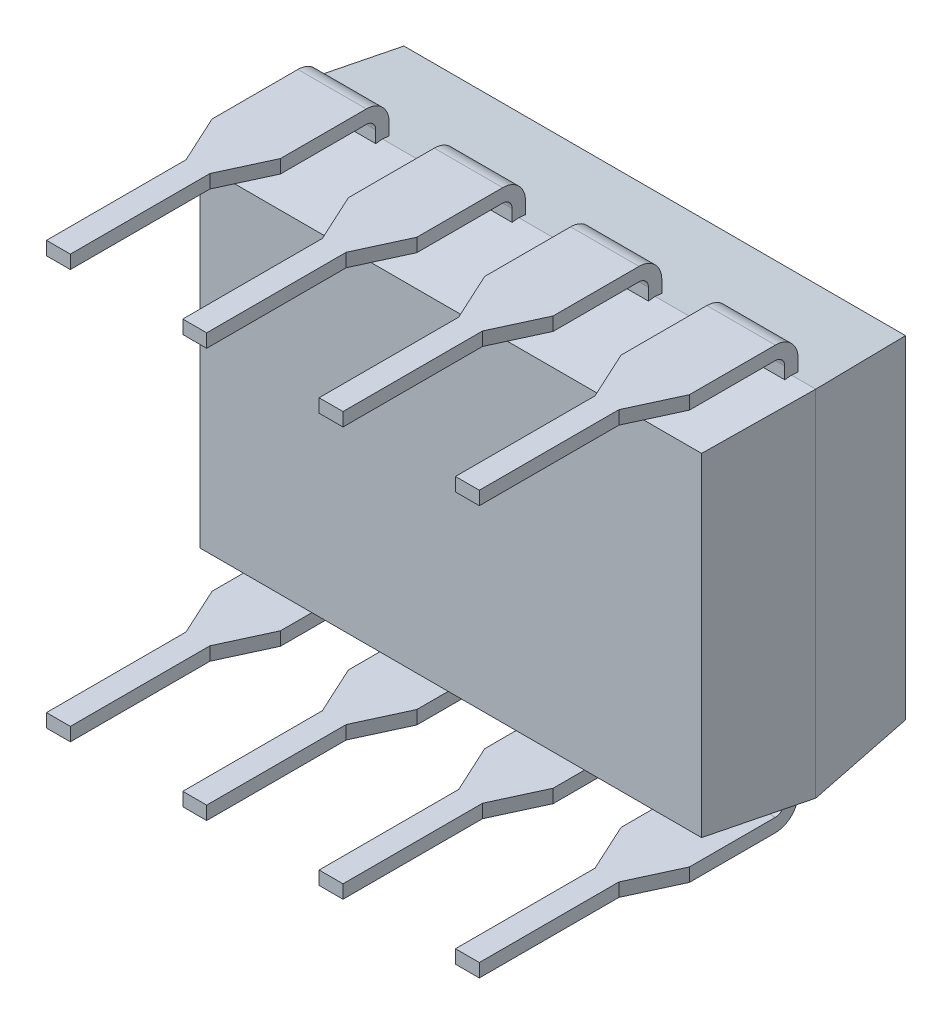
from build123d import *

# Parameters (mm, degrees)
RESSALTO_EXTRUS_O1_DEPTH        = 4.9
CORTE_EXTRUS_O2_DEPTH           = 3.55
ESBO_O8_R                       = 1
CORTE_EXTRUS_O5_DEPTH           = 0.5
ESBO_O6_W                       = 1.275
ESBO_O6_H                       = 0.25
RESSALTO_EXTRUS_O2_DEPTH        = 0.025
ESBO_O7_W                       = 1.275
ESBO_O7_H                       = 0.25
CORTE_EXTRUS_O6_START           = -0.25
CORTE_EXTRUS_O6_DEPTH           = 0.25
ESBO_O10_W                      = 0.445
ESBO_O10_H                      = 0.25
RESSALTO_EXTRUS_O3_DEPTH        = 2.6
PADR_O_LINEAR1_COUNT            = 4
PADR_O_LINEAR1_PITCH            = 2.54
PADR_O_LINEAR1_COPY_1_SKETCH_W  = 1.275
PADR_O_LINEAR1_COPY_1_SKETCH_H  = 0.25
PADR_O_LINEAR1_COPY_1_DEPTH     = 0.025
PADR_O_LINEAR1_COPY_2_SKETCH_W  = 1.275
PADR_O_LINEAR1_COPY_2_SKETCH_H  = 0.25
PADR_O_LINEAR1_COPY_2_DEPTH     = 0.025
PADR_O_LINEAR1_COPY_3_SKETCH_W  = 1.275
PADR_O_LINEAR1_COPY_3_SKETCH_H  = 0.25
PADR_O_LINEAR1_COPY_3_DEPTH     = 0.025
PADR_O_LINEAR1_COPY_4_SKETCH_W  = 1.275
PADR_O_LINEAR1_COPY_4_SKETCH_H  = 0.25
PADR_O_LINEAR1_COPY_5_SKETCH_W  = 1.275
PADR_O_LINEAR1_COPY_5_SKETCH_H  = 0.25
PADR_O_LINEAR1_COPY_6_SKETCH_W  = 1.275
PADR_O_LINEAR1_COPY_6_SKETCH_H  = 0.25
PADR_O_START                    = -0.25
PADR_O_LINEAR1_COPY_7_DEPTH     = 0.25
PADR_O_LINEAR1_COPY_8_DEPTH     = 0.25
PADR_O_LINEAR1_COPY_9_DEPTH     = 0.25
PADR_O_LINEAR1_COPY_10_SKETCH_W = 0.445
PADR_O_LINEAR1_COPY_10_SKETCH_H = 0.25
PADR_O_LINEAR1_COPY_10_DEPTH    = 2.6
PADR_O_LINEAR1_COPY_11_SKETCH_W = 0.445
PADR_O_LINEAR1_COPY_11_SKETCH_H = 0.25
PADR_O_LINEAR1_COPY_11_DEPTH    = 2.6
PADR_O_LINEAR1_COPY_12_SKETCH_W = 0.445
PADR_O_LINEAR1_COPY_12_SKETCH_H = 0.25
PADR_O_LINEAR1_COPY_12_DEPTH    = 2.6


with BuildPart() as part:
    # Esboço1 → Ressalto-extrusão1 (new, symmetric)
    with BuildSketch(Plane(origin=(0, 0, 0), x_dir=(0, 0, -1), z_dir=(1, 0, 0))):
        Polygon((0.9, 3.1), (0.9, -3.1), (2.8, -3.3), (4.7, -3.1), (4.7, 3.1), (2.8, 3.3), align=None)
    extrude(amount=RESSALTO_EXTRUS_O1_DEPTH, both=True)

    # Esboço3 → Corte-extrusão2 (cut, symmetric)
    with BuildSketch(Plane(origin=(0, 0, 0), x_dir=(1, 0, 0), z_dir=(0, 1, 0))):
        Polygon((-4.9, 2.8), (-4.669897634, 4.726835982), (-5.836348907, 4.726835982), (-5.836348907, 0.873164018), (-4.669897634, 0.873164018), align=None)
    corte_extrus_o2 = extrude(amount=CORTE_EXTRUS_O2_DEPTH, both=True, mode=Mode.SUBTRACT)

    # Espelhar1: Corte-extrusão2 across plane
    add(corte_extrus_o2.mirror(Plane(origin=(0, 0, 0), x_dir=(0, 0, 1), z_dir=(1, 0, 0))), mode=Mode.SUBTRACT)

    # Esboço8 → Corte-extrusão5 (cut)
    with BuildSketch(Plane(origin=(0, 0, -4.7), x_dir=(-1, 0, 0), z_dir=(0, 0, -1))):
        with Locations((4.673102382, 0)):
            Circle(ESBO_O8_R)
    extrude(amount=-CORTE_EXTRUS_O5_DEPTH, mode=Mode.SUBTRACT)

    # Esboço6 → Ressalto-extrusão2 (add, symmetric)
    with BuildSketch(Plane(origin=(0, 3.3, 0), x_dir=(1, 0, 0), z_dir=(0, 1, 0))):
        with Locations((-3.81, 2.8)):
            Rectangle(ESBO_O6_W, ESBO_O6_H)
    ressalto_extrus_o2 = extrude(amount=RESSALTO_EXTRUS_O2_DEPTH, both=True)

    # Varredura1: sweep along a curve in space
    with BuildLine() as varredura1_path:
        Line((-3.81, 3.325, -2.8), (-3.81, 3.51, -2.8))
        ThreePointArc((-3.81, 3.51, -2.8), (-3.81, 3.722132034, -2.712132034), (-3.81, 3.81, -2.5))
        Line((-3.81, 3.81, -2.5), (-3.81, 3.81, 0))
    # Esboço7 → Varredura1 (sweep)
    with BuildSketch(Plane(origin=(0, 3.325, 0), x_dir=(1, 0, 0), z_dir=(0, 1, 0))):
        with Locations((-3.81, 2.8)):
            Rectangle(ESBO_O7_W, ESBO_O7_H)
    varredura1 = sweep(path=varredura1_path.line)

    # Esboço9 → Corte-extrusão6 (cut)
    with BuildSketch(Plane(origin=(0, 3.935, 0), x_dir=(1, 0, 0), z_dir=(0, 1, 0)).offset(CORTE_EXTRUS_O6_START)):
        Polygon((-4.0325, 0), (-4.4475, 0.9), (-4.4475, -0.2), (-3.1725, -0.2), (-3.1725, 0.9), (-3.5875, 0), align=None)
    corte_extrus_o6 = extrude(amount=CORTE_EXTRUS_O6_DEPTH, mode=Mode.SUBTRACT)

    # Esboço10 → Ressalto-extrusão3 (add)
    with BuildSketch(Plane.XY):
        with Locations((-3.81, 3.81)):
            Rectangle(ESBO_O10_W, ESBO_O10_H)
    ressalto_extrus_o3 = extrude(amount=RESSALTO_EXTRUS_O3_DEPTH)

    # Espelhar2: Ressalto-extrusão2, Varredura1, Corte-extrusão6, Ressalto-extrusão3 across plane
    add(ressalto_extrus_o2.mirror(Plane.ZX))
    add(varredura1.mirror(Plane.ZX))
    add(corte_extrus_o6.mirror(Plane.ZX), mode=Mode.SUBTRACT)
    add(ressalto_extrus_o3.mirror(Plane.ZX))

    # Padrão linear1: Ressalto-extrusão2, Varredura1, Corte-extrusão6, Ressalto-extrusão3 ×4
    with Locations(*[(i * PADR_O_LINEAR1_PITCH, 0, 0) for i in range(1, PADR_O_LINEAR1_COUNT)]):
        add(ressalto_extrus_o2)
        add(varredura1)
        add(corte_extrus_o6, mode=Mode.SUBTRACT)
        add(ressalto_extrus_o3)

    # Padrão linear1 copy 1 sketch → Padrão linear1 copy 1 (add, symmetric)
    with BuildSketch(Plane(origin=(2.54, -3.3, 0), x_dir=(1, 0, 0), z_dir=(0, -1, 0))):
        with Locations((-3.81, -2.8)):
            Rectangle(PADR_O_LINEAR1_COPY_1_SKETCH_W, PADR_O_LINEAR1_COPY_1_SKETCH_H)
    extrude(amount=PADR_O_LINEAR1_COPY_1_DEPTH, both=True)

    # Padrão linear1 copy 2 sketch → Padrão linear1 copy 2 (add, symmetric)
    with BuildSketch(Plane(origin=(5.08, -3.3, 0), x_dir=(1, 0, 0), z_dir=(0, -1, 0))):
        with Locations((-3.81, -2.8)):
            Rectangle(PADR_O_LINEAR1_COPY_2_SKETCH_W, PADR_O_LINEAR1_COPY_2_SKETCH_H)
    extrude(amount=PADR_O_LINEAR1_COPY_2_DEPTH, both=True)

    # Padrão linear1 copy 3 sketch → Padrão linear1 copy 3 (add, symmetric)
    with BuildSketch(Plane(origin=(7.62, -3.3, 0), x_dir=(1, 0, 0), z_dir=(0, -1, 0))):
        with Locations((-3.81, -2.8)):
            Rectangle(PADR_O_LINEAR1_COPY_3_SKETCH_W, PADR_O_LINEAR1_COPY_3_SKETCH_H)
    extrude(amount=PADR_O_LINEAR1_COPY_3_DEPTH, both=True)

    # Padrão linear1 copy 4: sweep along a curve in space
    with BuildLine() as padr_o_linear1_copy_4_path:
        Line((-1.27, -3.325, -2.8), (-1.27, -3.51, -2.8))
        ThreePointArc((-1.27, -3.51, -2.8), (-1.27, -3.722132034, -2.712132034), (-1.27, -3.81, -2.5))
        Line((-1.27, -3.81, -2.5), (-1.27, -3.81, 0))
    # Padrão linear1 copy 4 sketch → Padrão linear1 copy 4 (sweep)
    with BuildSketch(Plane(origin=(2.54, -3.325, 0), x_dir=(1, 0, 0), z_dir=(0, -1, 0))):
        with Locations((-3.81, -2.8)):
            Rectangle(PADR_O_LINEAR1_COPY_4_SKETCH_W, PADR_O_LINEAR1_COPY_4_SKETCH_H)
    sweep(path=padr_o_linear1_copy_4_path.line)

    # Padrão linear1 copy 5: sweep along a curve in space
    with BuildLine() as padr_o_linear1_copy_5_path:
        Line((1.27, -3.325, -2.8), (1.27, -3.51, -2.8))
        ThreePointArc((1.27, -3.51, -2.8), (1.27, -3.722132034, -2.712132034), (1.27, -3.81, -2.5))
        Line((1.27, -3.81, -2.5), (1.27, -3.81, 0))
    # Padrão linear1 copy 5 sketch → Padrão linear1 copy 5 (sweep)
    with BuildSketch(Plane(origin=(5.08, -3.325, 0), x_dir=(1, 0, 0), z_dir=(0, -1, 0))):
        with Locations((-3.81, -2.8)):
            Rectangle(PADR_O_LINEAR1_COPY_5_SKETCH_W, PADR_O_LINEAR1_COPY_5_SKETCH_H)
    sweep(path=padr_o_linear1_copy_5_path.line)

    # Padrão linear1 copy 6: sweep along a curve in space
    with BuildLine() as padr_o_linear1_copy_6_path:
        Line((3.81, -3.325, -2.8), (3.81, -3.51, -2.8))
        ThreePointArc((3.81, -3.51, -2.8), (3.81, -3.722132034, -2.712132034), (3.81, -3.81, -2.5))
        Line((3.81, -3.81, -2.5), (3.81, -3.81, 0))
    # Padrão linear1 copy 6 sketch → Padrão linear1 copy 6 (sweep)
    with BuildSketch(Plane(origin=(7.62, -3.325, 0), x_dir=(1, 0, 0), z_dir=(0, -1, 0))):
        with Locations((-3.81, -2.8)):
            Rectangle(PADR_O_LINEAR1_COPY_6_SKETCH_W, PADR_O_LINEAR1_COPY_6_SKETCH_H)
    sweep(path=padr_o_linear1_copy_6_path.line)

    # Padrão linear1 copy 7 sketch → Padrão linear1 copy 7 (cut)
    with BuildSketch(Plane(origin=(2.54, -3.935, 0), x_dir=(1, 0, 0), z_dir=(0, -1, 0)).offset(PADR_O_START)):
        Polygon((-4.0325, 0), (-4.4475, -0.9), (-4.4475, 0.2), (-3.1725, 0.2), (-3.1725, -0.9), (-3.5875, 0), align=None)
    extrude(amount=PADR_O_LINEAR1_COPY_7_DEPTH, mode=Mode.SUBTRACT)

    # Padrão linear1 copy 8 sketch → Padrão linear1 copy 8 (cut)
    with BuildSketch(Plane(origin=(5.08, -3.935, 0), x_dir=(1, 0, 0), z_dir=(0, -1, 0)).offset(PADR_O_START)):
        Polygon((-4.0325, 0), (-4.4475, -0.9), (-4.4475, 0.2), (-3.1725, 0.2), (-3.1725, -0.9), (-3.5875, 0), align=None)
    extrude(amount=PADR_O_LINEAR1_COPY_8_DEPTH, mode=Mode.SUBTRACT)

    # Padrão linear1 copy 9 sketch → Padrão linear1 copy 9 (cut)
    with BuildSketch(Plane(origin=(7.62, -3.935, 0), x_dir=(1, 0, 0), z_dir=(0, -1, 0)).offset(PADR_O_START)):
        Polygon((-4.0325, 0), (-4.4475, -0.9), (-4.4475, 0.2), (-3.1725, 0.2), (-3.1725, -0.9), (-3.5875, 0), align=None)
    extrude(amount=PADR_O_LINEAR1_COPY_9_DEPTH, mode=Mode.SUBTRACT)

    # Padrão linear1 copy 10 sketch → Padrão linear1 copy 10 (add)
    with BuildSketch(Plane(origin=(2.54, 0, 0), x_dir=(1, 0, 0), z_dir=(0, 0, 1))):
        with Locations((-3.81, -3.81)):
            Rectangle(PADR_O_LINEAR1_COPY_10_SKETCH_W, PADR_O_LINEAR1_COPY_10_SKETCH_H)
    extrude(amount=PADR_O_LINEAR1_COPY_10_DEPTH)

    # Padrão linear1 copy 11 sketch → Padrão linear1 copy 11 (add)
    with BuildSketch(Plane(origin=(5.08, 0, 0), x_dir=(1, 0, 0), z_dir=(0, 0, 1))):
        with Locations((-3.81, -3.81)):
            Rectangle(PADR_O_LINEAR1_COPY_11_SKETCH_W, PADR_O_LINEAR1_COPY_11_SKETCH_H)
    extrude(amount=PADR_O_LINEAR1_COPY_11_DEPTH)

    # Padrão linear1 copy 12 sketch → Padrão linear1 copy 12 (add)
    with BuildSketch(Plane(origin=(7.62, 0, 0), x_dir=(1, 0, 0), z_dir=(0, 0, 1))):
        with Locations((-3.81, -3.81)):
            Rectangle(PADR_O_LINEAR1_COPY_12_SKETCH_W, PADR_O_LINEAR1_COPY_12_SKETCH_H)
    extrude(amount=PADR_O_LINEAR1_COPY_12_DEPTH)


solid = part.part
